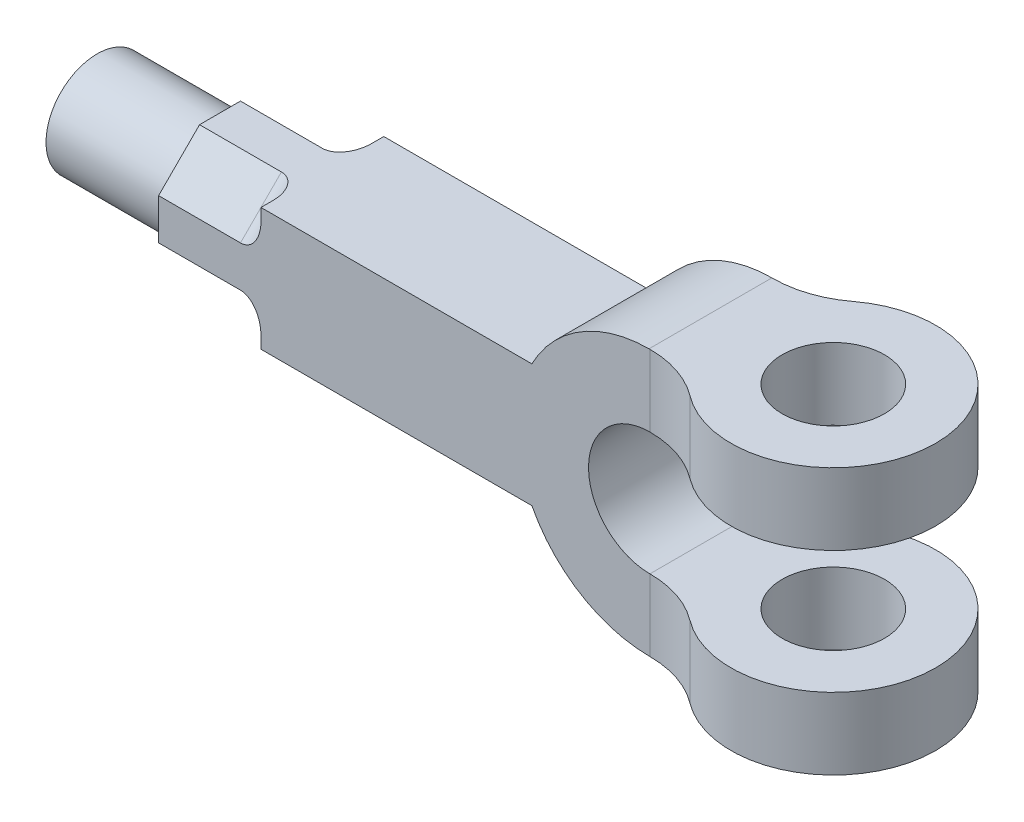
from build123d import *

# Parameters (mm, degrees)
BOSS_EXTRUDE1_DEPTH      = 14
BOSS_EXTRUDE2_DEPTH      = 12
BOSS_EXTRUDE2_DEPTH_BACK = 12
CUT_EXTRUDE1_DEPTH       = 20
FILLET1_R                = 4
SKETCH5_R                = 10
BOSS_EXTRUDE3_DEPTH      = 24
SKETCH6_R                = 10
CUT_EXTRUDE2_DEPTH       = 78


with BuildPart() as part:
    # Sketch1 → Boss-Extrude1 (new body)
    with BuildSketch(Plane(origin=(0, 0, 0), x_dir=(1, 0, 0), z_dir=(0, 1, 0))):
        with BuildLine():
            Line((-24, 12), (-24, -12))
            Line((-24, -12), (-23.832750576, -12))
            ThreePointArc((-23.832750576, -12), (-17.627403759, -13.013689636), (-12.067215481, -15.949367089))
            ThreePointArc((-12.067215481, -15.949367089), (20, 0), (-12.067215481, 15.949367089))
            ThreePointArc((-12.067215481, 15.949367089), (-17.627403759, 13.013689636), (-23.832750576, 12))
            Line((-23.832750576, 12), (-24, 12))
        make_face()
    boss_extrude1 = extrude(amount=BOSS_EXTRUDE1_DEPTH)

    # Sketch3 → Boss-Extrude2 (add, two sides: drawn at the far end of the back side and taken through both)
    with BuildSketch(Plane.XY.offset(-BOSS_EXTRUDE2_DEPTH_BACK)):
        with BuildLine():
            Line((-46.897875765, 0), (-119.832750576, 0))
            Line((-119.832750576, 0), (-119.832750576, -24))
            Line((-119.832750576, -24), (-46.897875765, -24))
            ThreePointArc((-46.897875765, -24), (-37.323488139, -34.226110771), (-23.832750576, -38))
            Line((-23.832750576, -38), (-23.832750576, -24))
            ThreePointArc((-23.832750576, -24), (-35.832750576, -12), (-23.832750576, 0))
            Line((-23.832750576, 0), (-23.832750576, 14))
            ThreePointArc((-23.832750576, 14), (-37.323488139, 10.226110771), (-46.897875765, 0))
        make_face()
    extrude(amount=BOSS_EXTRUDE2_DEPTH + BOSS_EXTRUDE2_DEPTH_BACK)

    # Sketch4 → Cut-Extrude1 (cut)
    with BuildSketch(Plane.ZY.offset(119.832750576)):
        Polygon((-12, 0), (-4, 0), (-12, -8), align=None)
        Polygon((4, 0), (12, -8), (12, 0), align=None)
        Polygon((12, -16), (4, -24), (12, -24), align=None)
        Polygon((-4, -24), (-12, -16), (-12, -24), align=None)
    extrude(amount=-CUT_EXTRUDE1_DEPTH, mode=Mode.SUBTRACT)

    # Fillet1
    fillet1_edges = [part.edges().sort_by_distance(p)[0] for p in [
        (-99.832750576, -20, -8),
        (-99.832750576, -20, 8),
        (-99.832750576, -4, 8),
        (-99.832750576, -4, -8),
    ]]
    fillet(fillet1_edges, radius=FILLET1_R)

    # Sketch5 → Boss-Extrude3 (add)
    with BuildSketch(Plane.ZY.offset(119.832750576)):
        with Locations((0, -12)):
            Circle(SKETCH5_R)
    extrude(amount=BOSS_EXTRUDE3_DEPTH)

    # Mirror1: Boss-Extrude1 across plane
    add(boss_extrude1.mirror(Plane.ZX.offset(-12)))

    # Sketch6 → Cut-Extrude2 (cut)
    with BuildSketch(Plane(origin=(0, 14, 0), x_dir=(1, 0, 0), z_dir=(0, 1, 0))):
        with Locations(Location((0, 0, 0), (0, 0, 90))):
            Circle(SKETCH6_R)
    extrude(amount=-CUT_EXTRUDE2_DEPTH, mode=Mode.SUBTRACT)


solid = part.part
